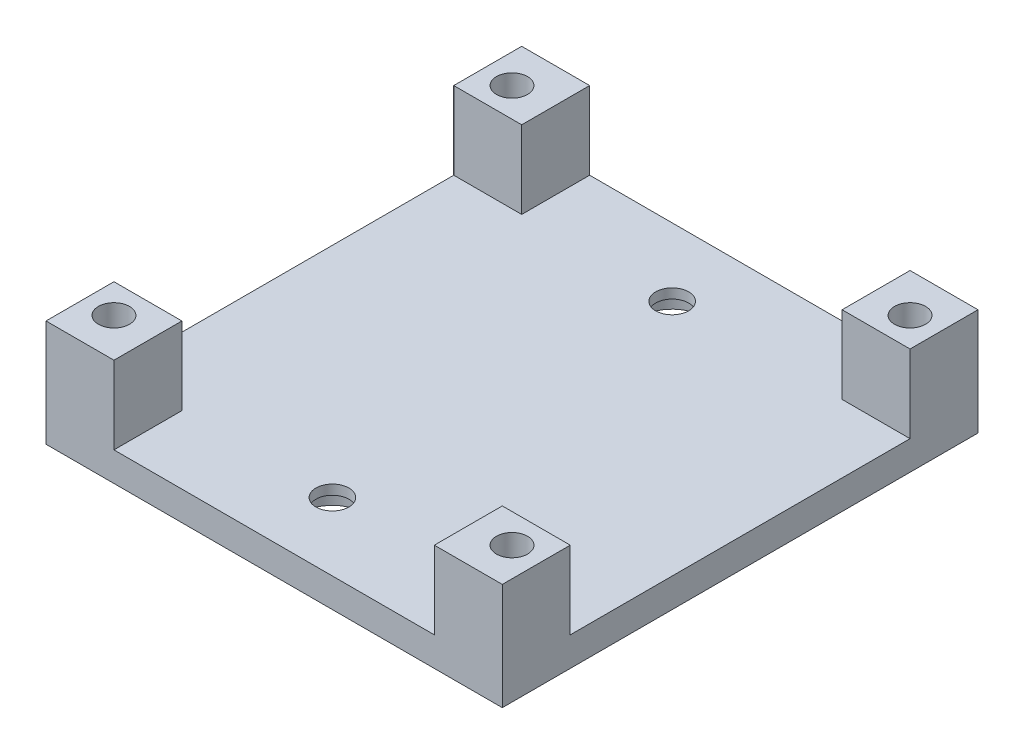
from build123d import *

# Parameters (mm, degrees)
CROQUIS1_W                                           = 47
CROQUIS1_H                                           = 49
SALIENTE_EXTRUIR1_DEPTH                              = 3
CROQUIS14_W                                          = 7
CROQUIS14_H                                          = 7
SALIENTE_EXTRUIR4_DEPTH                              = 8
TALADRO_DE_MARGEN_PARA_M35_D                         = 3.2
REFRENTADO_PARA_TORNILLO_CON_CABEZA_PLAN_D           = 3.4
REFRENTADO_PARA_TORNILLO_CON_CABEZA_PLAN_CBORE_D     = 6.5
REFRENTADO_PARA_TORNILLO_CON_CABEZA_PLAN_CBORE_DEPTH = 2
CROQUIS25_R                                          = 4.75
CORTAR_EXTRUIR4_DEPTH                                = 2.54


with BuildPart() as part:
    # Croquis1 → Saliente-Extruir1 (new body)
    with BuildSketch(Plane(origin=(0, 0, 0), x_dir=(1, 0, 0), z_dir=(0, 1, 0))):
        with Locations((23.5, 24.5)):
            Rectangle(CROQUIS1_W, CROQUIS1_H)
    extrude(amount=SALIENTE_EXTRUIR1_DEPTH)

    # Croquis14 → Saliente-Extruir4 (add)
    with BuildSketch(Plane(origin=(0, 3, 0), x_dir=(1, 0, 0), z_dir=(0, 1, 0))):
        with Locations((3.5, 45.5)):
            Rectangle(CROQUIS14_W, CROQUIS14_H)
        with Locations((43.5, 45.5)):
            Rectangle(CROQUIS14_W, CROQUIS14_H)
        with Locations((43.5, 3.5)):
            Rectangle(CROQUIS14_W, CROQUIS14_H)
        with Locations((3.5, 3.5)):
            Rectangle(CROQUIS14_W, CROQUIS14_H)
    extrude(amount=SALIENTE_EXTRUIR4_DEPTH)

    # Taladro de margen para M35 (through all)
    with Locations(Plane(origin=(3, 0, -4), x_dir=(0, 0, -1), z_dir=(0, -1, 0))):
        with Locations((0, 0), (0, 41), (41, 41), (41, 0)):
            Hole(TALADRO_DE_MARGEN_PARA_M35_D / 2)

    # Refrentado para tornillo con cabeza plana de M31 (through all)
    with Locations(Plane(origin=(22.5, 0, -7), x_dir=(0, 0, -1), z_dir=(0, -1, 0))):
        with Locations((0, 0), (35, 0)):
            CounterBoreHole(REFRENTADO_PARA_TORNILLO_CON_CABEZA_PLAN_D / 2, REFRENTADO_PARA_TORNILLO_CON_CABEZA_PLAN_CBORE_D / 2, REFRENTADO_PARA_TORNILLO_CON_CABEZA_PLAN_CBORE_DEPTH)

    # Croquis25 → Cortar-Extruir4 (cut)
    with BuildSketch(Plane.XZ):
        with Locations(Location((11.75, -12.25, 0), (0, 0, 270))):
            Circle(CROQUIS25_R)
        with Locations(Location((35.25, -12.25, 0), (0, 0, 90))):
            Circle(CROQUIS25_R)
        with Locations(Location((35.25, -36.75, 0), (0, 0, 270))):
            Circle(CROQUIS25_R)
        with Locations(Location((11.75, -36.75, 0), (0, 0, 90))):
            Circle(CROQUIS25_R)
    extrude(amount=-CORTAR_EXTRUIR4_DEPTH, mode=Mode.SUBTRACT)


solid = part.part
